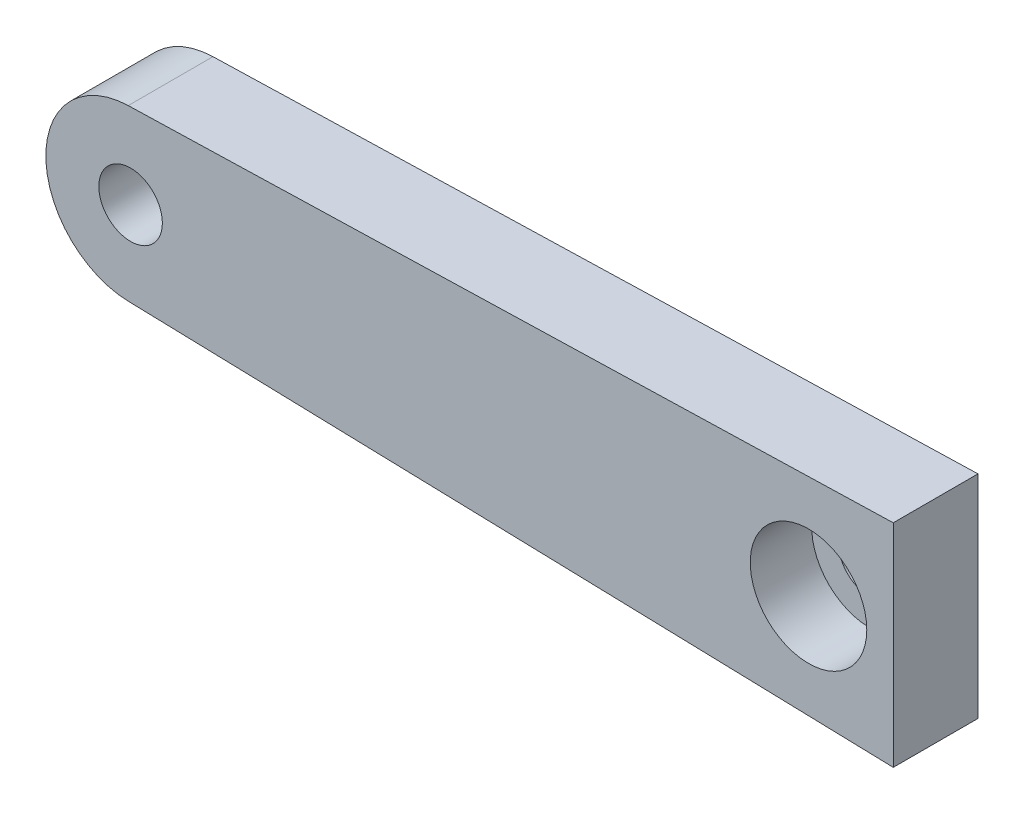
from build123d import *

# Parameters (mm, degrees)
SKETCH_1_R          = 1.5
EXTRUDE_1_DEPTH     = 4
SKETCH_2_R          = 2.75
CUT_EXTRUDE_1_DEPTH = 2.9


with BuildPart() as part:
    # 草图1 → 凸台-拉伸1 (new body)
    with BuildSketch(Plane.XY):
        with BuildLine():
            Line((-32.110897558, 3.998462421), (4, 5))
            Line((4, 5), (4, -5))
            Line((4, -5), (-32.110897558, -3.998462421))
            ThreePointArc((-32.110897558, -3.998462421), (-36, 0), (-32.110897558, 3.998462421))
        make_face()
        Circle(SKETCH_1_R, mode=Mode.SUBTRACT)
        with Locations((-32, 0)):
            Circle(SKETCH_1_R, mode=Mode.SUBTRACT)
    extrude(amount=EXTRUDE_1_DEPTH)

    # 草图2 → 切除-拉伸1 (cut)
    with BuildSketch(Plane.XY.offset(4)):
        Circle(SKETCH_2_R)
    extrude(amount=-CUT_EXTRUDE_1_DEPTH, mode=Mode.SUBTRACT)


solid = part.part
